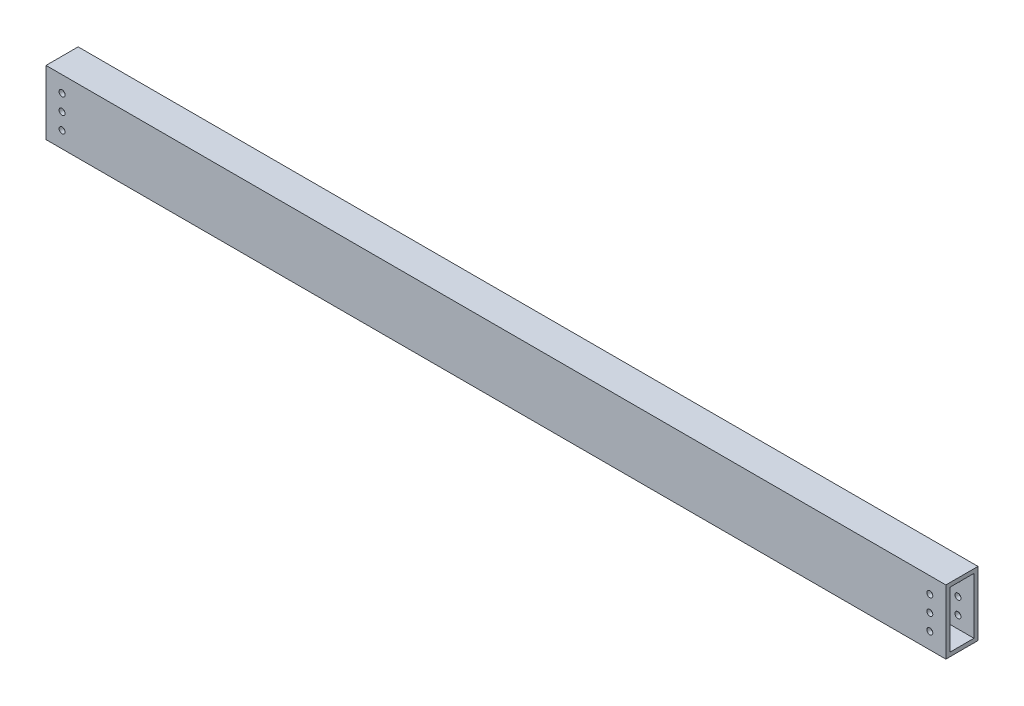
from build123d import *

# Parameters (mm, degrees)
SKETCH1_W           = 25.4
SKETCH1_H           = 50.8
BOSS_EXTRUDE1_DEPTH = 355.6
SHELL1_T            = -3.175
SKETCH2_R           = 2.38125
CUT_EXTRUDE1_DEPTH  = 358.409680899


with BuildPart() as part:
    # Sketch1 → Boss-Extrude1 (new, symmetric)
    with BuildSketch(Plane(origin=(0, 0, 0), x_dir=(0, 0, -1), z_dir=(1, 0, 0))):
        Rectangle(SKETCH1_W, SKETCH1_H)
    extrude(amount=BOSS_EXTRUDE1_DEPTH, both=True)

    # Shell1
    shell1_openings = [part.faces().sort_by_distance(p)[0] for p in [
        (355.6, 0, 0),
        (-355.6, 0, 0),
    ]]
    offset(amount=SHELL1_T, openings=shell1_openings, kind=Kind.INTERSECTION)

    # Sketch2 → Cut-Extrude1 (cut, through all)
    with BuildSketch(Plane.XY.offset(12.7)):
        with Locations((-342.9, 12.7)):
            Circle(SKETCH2_R)
        with Locations((-342.9, 0)):
            Circle(SKETCH2_R)
        with Locations((-342.9, -12.7)):
            Circle(SKETCH2_R)
        with Locations(Location((342.9, -12.7, 0), (0, 0, 180))):
            Circle(SKETCH2_R)
        with Locations(Location((342.9, 0, 0), (0, 0, 180))):
            Circle(SKETCH2_R)
        with Locations(Location((342.9, 12.7, 0), (0, 0, 180))):
            Circle(SKETCH2_R)
    extrude(amount=-CUT_EXTRUDE1_DEPTH, mode=Mode.SUBTRACT)


solid = part.part
